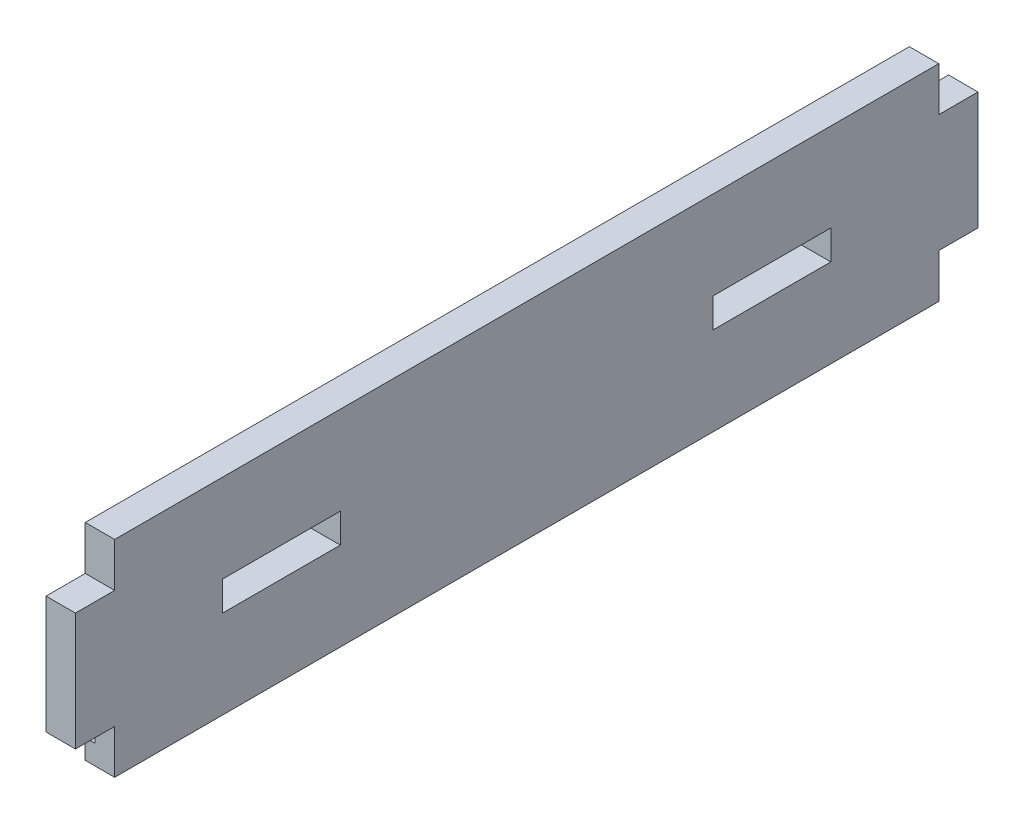
from build123d import *

# Parameters (mm, degrees)
SKETCH1_W           = 19.05
SKETCH1_H           = 133.35
BOSS_EXTRUDE1_DEPTH = 584.2
SKETCH2_W           = 76.2
SKETCH2_H           = 19.05
SKETCH2_W_2         = 25.4
SKETCH2_H_2         = 28.575
CUT_EXTRUDE1_DEPTH  = 920.17672153
SKETCH3_W           = 6.35
SKETCH3_H           = 6.35
CUT_EXTRUDE2_DEPTH  = 49089.059018009


with BuildPart() as part:
    # Sketch1 → Boss-Extrude1 (new body)
    with BuildSketch(Plane.XY):
        with Locations((49069.931142185, 642.714387363)):
            Rectangle(SKETCH1_W, SKETCH1_H)
    extrude(amount=BOSS_EXTRUDE1_DEPTH)

    # Sketch2 → Cut-Extrude1 (cut, through all)
    with BuildSketch(Plane.ZY.offset(-49060.406142185)):
        with Locations((133.35, 642.714387363)):
            Rectangle(SKETCH2_W, SKETCH2_H)
        with Locations((450.85, 642.714387363)):
            Rectangle(SKETCH2_W, SKETCH2_H)
        with Locations((571.5, 695.101887363)):
            Rectangle(SKETCH2_W_2, SKETCH2_H_2)
        with Locations((12.7, 695.101887363)):
            Rectangle(SKETCH2_W_2, SKETCH2_H_2)
        with Locations((12.7, 590.326887363)):
            Rectangle(SKETCH2_W_2, SKETCH2_H_2)
        with Locations((571.5, 590.326887363)):
            Rectangle(SKETCH2_W_2, SKETCH2_H_2)
    extrude(amount=-CUT_EXTRUDE1_DEPTH, mode=Mode.SUBTRACT)

    # Sketch3 → Cut-Extrude2 (cut, through all)
    with BuildSketch(Plane.XY.offset(584.2)):
        with Locations((49063.581142185, 591.914387363)):
            Rectangle(SKETCH3_W, SKETCH3_H)
    extrude(amount=-CUT_EXTRUDE2_DEPTH, mode=Mode.SUBTRACT)


solid = part.part
